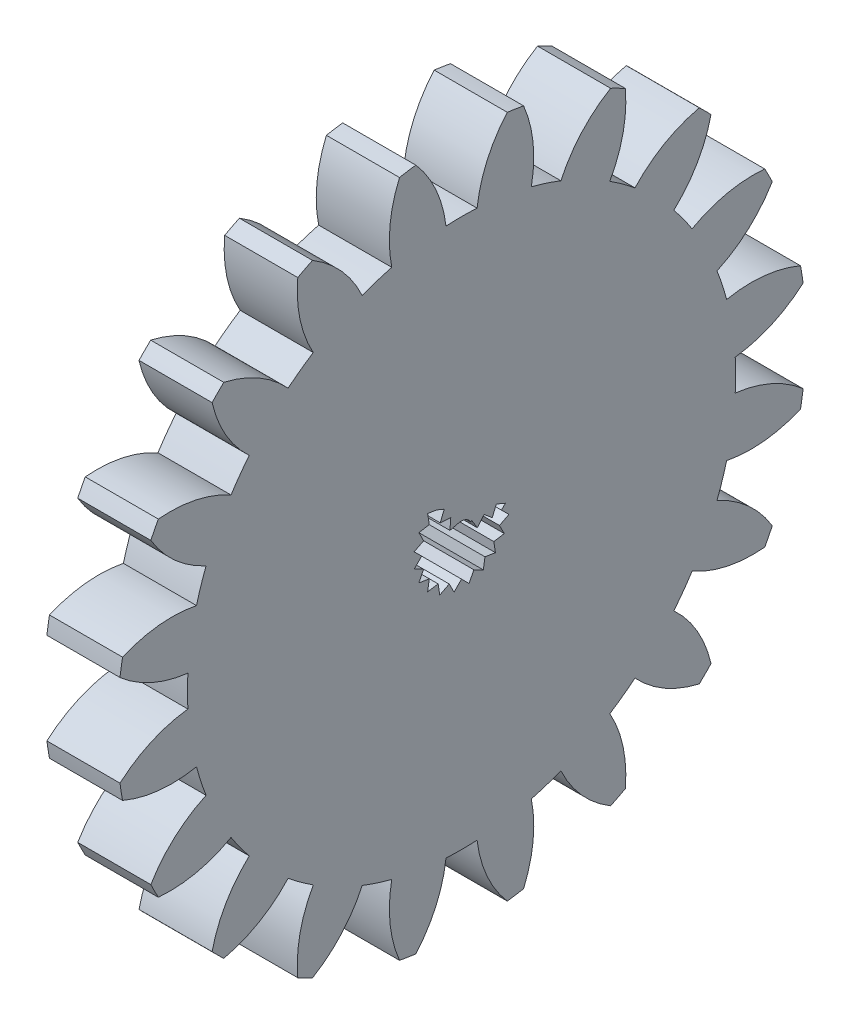
from build123d import *

# Parameters (mm, degrees)
BASPROSKE_W        = 3.5
BASPROSKE_H        = 16.5
TOOTHCUT_DEPTH     = 24.595550428
TEETHCUTS_COUNT    = 20
TEETHCUTS_ANGLE    = 342
BORSKE_R           = 0.5
BORE_DEPTH         = 50.0000508
CUT_EXTRUDE1_DEPTH = 10


with BuildPart() as part:
    # BasProSke → Base-Revolve (revolve)
    with BuildSketch(Plane(origin=(0, 0, 0), x_dir=(1, 0, 0), z_dir=(0, 1, 0)), mode=Mode.PRIVATE) as base_revolve_sk:
        with Locations((1.75, 8.25)):
            Rectangle(BASPROSKE_W, BASPROSKE_H)
    revolve(base_revolve_sk.sketch.rotate(Axis((-10, 0, 0), (1, 0, 0)), 180), axis=Axis((-10, 0, 0), (1, 0, 0)))

    # TooCutSke → ToothCut (cut, through all)
    with BuildSketch(Plane(origin=(0, 0, 0), x_dir=(0, 0, -1), z_dir=(1, 0, 0))):
        with BuildLine():
            ThreePointArc((0.74381438, 13.102904875), (0, 13.124), (-0.74381438, 13.102904875))
            ThreePointArc((-0.74381438, 13.102904875), (-1.226473103, 14.852072512), (-2.209965745, 16.376962373))
            ThreePointArc((-2.209965745, 16.376962373), (0, 16.5254), (2.209965745, 16.376962373))
            ThreePointArc((2.209965745, 16.376962373), (1.226473103, 14.852072512), (0.74381438, 13.102904875))
        make_face()
    toothcut = extrude(amount=TOOTHCUT_DEPTH, mode=Mode.SUBTRACT)

    # TeethCuts: ToothCut ×20 about axis
    teethcuts_axis = Axis((-10, 0, 0), (1, 0, 0))
    for i in range(1, TEETHCUTS_COUNT):
        add(toothcut.rotate(teethcuts_axis, i * TEETHCUTS_ANGLE / (TEETHCUTS_COUNT - 1)), mode=Mode.SUBTRACT)

    # BorSke → Bore (cut, symmetric)
    with BuildSketch(Plane(origin=(0, 0, 0), x_dir=(0, 0, -1), z_dir=(1, 0, 0))):
        with Locations(Location((0, 0, 0), (0, 0, 180))):
            Circle(BORSKE_R)
    extrude(amount=BORE_DEPTH, both=True, mode=Mode.SUBTRACT)

    # Sketch1 → Cut-Extrude1 (cut)
    with BuildSketch(Plane.ZY):
        Polygon((-1.083959973, 0.232340082), (-1.46991278, -0.097897743), (-1.664721638, 0.37121429), (-2.099317612, 0.190738968), (-1.908578644, 0), (-2.267755891, -0.359177248), (-1.815166156, -0.589783236), (-2.045772144, -1.042372971), (-1.544072558, -1.12183438), (-1.623533966, -1.623533966), (-1.12183438, -1.544072558), (-1.042372971, -2.045772144), (-0.589783236, -1.815166156), (-0.359177248, -2.267755891), (0, -1.908578644), (0.359177248, -2.267755891), (0.589783236, -1.815166156), (1.042372971, -2.045772144), (1.12183438, -1.544072558), (1.623533966, -1.623533966), (1.544072558, -1.12183438), (2.045772144, -1.042372971), (1.815166156, -0.589783236), (2.267755891, -0.359177248), (1.908578644, 0), (2.267755891, 0.359177248), (1.815166156, 0.589783236), (2.045772144, 1.042372971), (1.544072558, 1.12183438), (1.623533966, 1.623533966), (1.182876639, 1.553740702), (0.828023136, 1.406380155), (1.022831994, 0.937268122), (0.516480691, 0.896957479), (0.556791334, 0.390606175), (0.062765954, 0.508739633), (-0.055367504, 0.014714252), (-0.488708315, 0.279728085), (-0.753722148, -0.153612726), align=None)
    extrude(amount=-CUT_EXTRUDE1_DEPTH, mode=Mode.SUBTRACT)


solid = part.part
